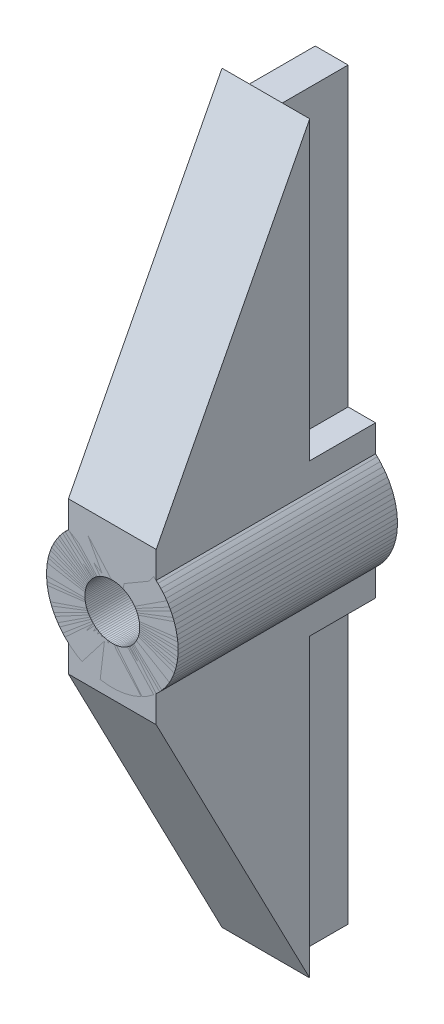
from build123d import *

# Parameters (mm, degrees)
SKETCH1_R             = 6
SKETCH1_R_2           = 2.5
BOSS_EXTRUDE1_DEPTH   = 20
BOSS_EXTRUDE2_DEPTH   = 4
SKETCH3_W             = 2.5
SKETCH3_H             = 6
CUT_EXTRUDE1_DEPTH    = 27.000002
BODY_MOVE_COPY1_ANGLE = 180


with BuildPart() as part:
    # Sketch1 → Boss-Extrude1 (new body)
    with BuildSketch(Plane.XY):
        Circle(SKETCH1_R)
        Circle(SKETCH1_R_2, mode=Mode.SUBTRACT)
    extrude(amount=BOSS_EXTRUDE1_DEPTH)

    # Sketch2 → Boss-Extrude2 (add, symmetric)
    with BuildSketch(Plane(origin=(0, 0, 0), x_dir=(0, 0, -1), z_dir=(1, 0, 0))):
        Polygon((-20, 6.9197719), (-20, 3.9197719), (0, 3.9197719), (0, 33.9197719), (-6, 33.9197719), align=None)
    extrude(amount=BOSS_EXTRUDE2_DEPTH, both=True)

    # Sketch3 → Cut-Extrude1 (cut)
    with BuildSketch(Plane(origin=(0, 33.9197719, 0), x_dir=(1, 0, 0), z_dir=(0, 1, 0))):
        with Locations((-2.75, -3)):
            Rectangle(SKETCH3_W, SKETCH3_H)
        with Locations((2.75, -3)):
            Rectangle(SKETCH3_W, SKETCH3_H)
    extrude(amount=-CUT_EXTRUDE1_DEPTH, mode=Mode.SUBTRACT)


with BuildPart() as body_2:
    # Body-Move/Copy1: copy of part
    add(part.part.rotate(Axis((0, 0, 0), (0, 0, 1)), BODY_MOVE_COPY1_ANGLE))


solid = Compound([part.part, body_2.part])
